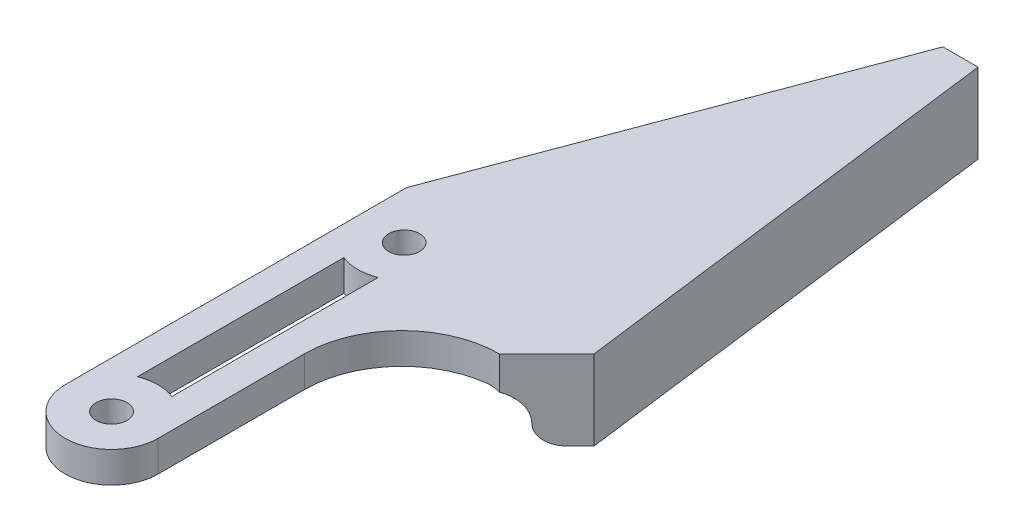
from build123d import *

# Parameters (mm, degrees)
CROQUIS1_R              = 1.5875
SALIENTE_EXTRUIR1_DEPTH = 3.175
CORTAR_EXTRUIR1_DEPTH   = 3.175
CORTAR_EXTRUIR3_DEPTH   = 10
CORTAR_EXTRUIR4_DEPTH   = 10
BOSS_EXTRU_1_DEPTH      = 8.18
CONG_1_R                = 2
CONG_2_R                = 3


with BuildPart() as part:
    # Croquis1 → Saliente-Extruir1 (new body)
    with BuildSketch(Plane(origin=(0, 0, 0), x_dir=(1, 0, 0), z_dir=(0, 1, 0))):
        with BuildLine():
            Line((-12.5, 0), (-12.5, -40))
            Line((-12.5, -40), (-2.975, -40))
            Line((-2.975, -40), (-2.975, -20))
            ThreePointArc((-2.975, -20), (-0.046067812, -12.928932188), (7.025, -10))
            Line((7.025, -10), (12.5, -10))
            Line((12.5, -10), (12.5, 40))
            Line((12.5, 40), (2.5, 40))
            Line((2.5, 40), (-12.5, 0))
        make_face()
        with Locations(Location((-7.7375, -5, 0), (0, 0, 270))):
            Circle(CROQUIS1_R, mode=Mode.SUBTRACT)
        with Locations(Location((-7.7375, -35, 0), (0, 0, 270))):
            Circle(CROQUIS1_R, mode=Mode.SUBTRACT)
    extrude(amount=SALIENTE_EXTRUIR1_DEPTH)

    # Croquis2 → Cortar-Extruir1 (cut)
    with BuildSketch(Plane(origin=(0, 3.175, 0), x_dir=(1, 0, 0), z_dir=(0, 1, 0))):
        Polygon((12.5, -10), (6.1, 40), (12.5, 40), align=None)
    extrude(amount=-CORTAR_EXTRUIR1_DEPTH, mode=Mode.SUBTRACT)

    # Croquis3 → Cortar-Extruir3 (cut)
    with BuildSketch(Plane(origin=(0, 3.175, 0), x_dir=(1, 0, 0), z_dir=(0, 1, 0))):
        with BuildLine():
            ThreePointArc((-5.975, -30.575635639), (-7.7375, -30.2375), (-9.5, -30.575635639))
            Line((-9.5, -30.575635639), (-9.5, -9.427055314))
            ThreePointArc((-9.5, -9.427055314), (-7.7375, -9.765), (-5.975, -9.427055314))
            Line((-5.975, -9.427055314), (-5.975, -14.803847577))
            Line((-5.975, -14.803847577), (-5.975, -30.575635639))
        make_face()
        with BuildLine():
            ThreePointArc((-12.5, -35), (-7.7375, -39.7625), (-2.975, -35))
            Line((-2.975, -35), (-2.975, -40))
            Line((-2.975, -40), (-12.5, -40))
            Line((-12.5, -40), (-12.5, -35))
        make_face()
    extrude(amount=-CORTAR_EXTRUIR3_DEPTH, mode=Mode.SUBTRACT)

    # Croquis4 → Cortar-Extruir4 (cut)
    with BuildSketch(Plane(origin=(0, 3.175, 0), x_dir=(1, 0, 0), z_dir=(0, 1, 0))):
        Polygon((7.025, -10), (11.878723404, -5.146276596), (12.5, -10), align=None)
    extrude(amount=-CORTAR_EXTRUIR4_DEPTH, mode=Mode.SUBTRACT)

    # Esquisse1 → Boss.-Extru.1 (add)
    with BuildSketch(Plane(origin=(0, 3.175, 0), x_dir=(1, 0, 0), z_dir=(0, 1, 0))):
        Polygon((11.878723404, -5.146276596), (6.1, 40), (2.5, 40), (8.687234043, -8.337765957), align=None)
    extrude(amount=-BOSS_EXTRU_1_DEPTH)

    # Congé1
    cong_1_edges = [part.edges().sort_by_distance(p)[0] for p in [
        (5.593617021, -5.005, -15.831117021),
    ]]
    fillet(cong_1_edges, radius=CONG_1_R)

    # Congé2
    cong_2_edges = [part.edges().sort_by_distance(p)[0] for p in [
        (5.593617021, 0, -15.831117021),
    ]]
    fillet(cong_2_edges, radius=CONG_2_R)


solid = part.part
